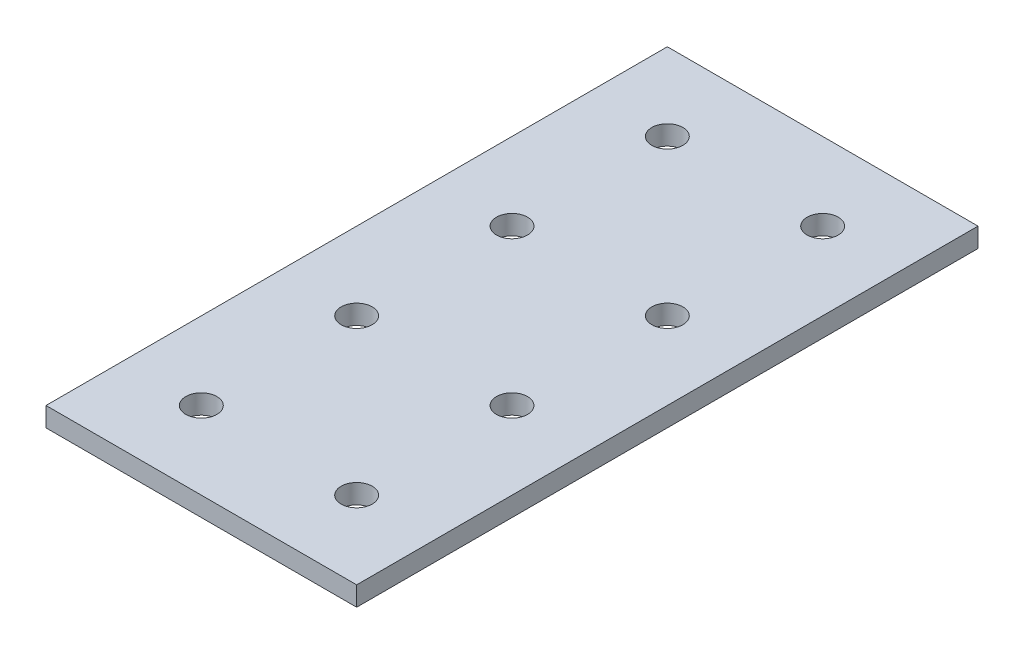
from build123d import *

# Parameters (mm, degrees)
BOSS_EXTRUDE1_DEPTH = 3.175
SKETCH2_R           = 2.54
CUT_EXTRUDE1_DEPTH  = 3.175


with BuildPart() as part:
    # Sketch1 → Boss-Extrude1 (new body)
    with BuildSketch(Plane(origin=(0, 0, 0), x_dir=(1, 0, 0), z_dir=(0, 1, 0))):
        Polygon((-38.1, -50.8), (12.7, -50.8), (12.7, 0), (12.7, 50.8), (-38.1, 50.8), align=None)
    extrude(amount=BOSS_EXTRUDE1_DEPTH)

    # Sketch2 → Cut-Extrude1 (cut)
    with BuildSketch(Plane(origin=(0, 3.175, 0), x_dir=(1, 0, 0), z_dir=(0, 1, 0))):
        with Locations(Location((-25.4, 38.1, 0), (0, 0, 270))):
            Circle(SKETCH2_R)
        with Locations(Location((-25.4, 12.7, 0), (0, 0, 270))):
            Circle(SKETCH2_R)
        with Locations(Location((-25.4, -12.7, 0), (0, 0, 270))):
            Circle(SKETCH2_R)
        with Locations(Location((-25.4, -38.1, 0), (0, 0, 270))):
            Circle(SKETCH2_R)
        with Locations(Location((0, 12.7, 0), (0, 0, 270))):
            Circle(SKETCH2_R)
        with Locations(Location((0, -12.7, 0), (0, 0, 270))):
            Circle(SKETCH2_R)
        with Locations(Location((0, -38.1, 0), (0, 0, 270))):
            Circle(SKETCH2_R)
        with Locations(Location((0, 38.1, 0), (0, 0, 270))):
            Circle(SKETCH2_R)
    extrude(amount=-CUT_EXTRUDE1_DEPTH, mode=Mode.SUBTRACT)


solid = part.part
